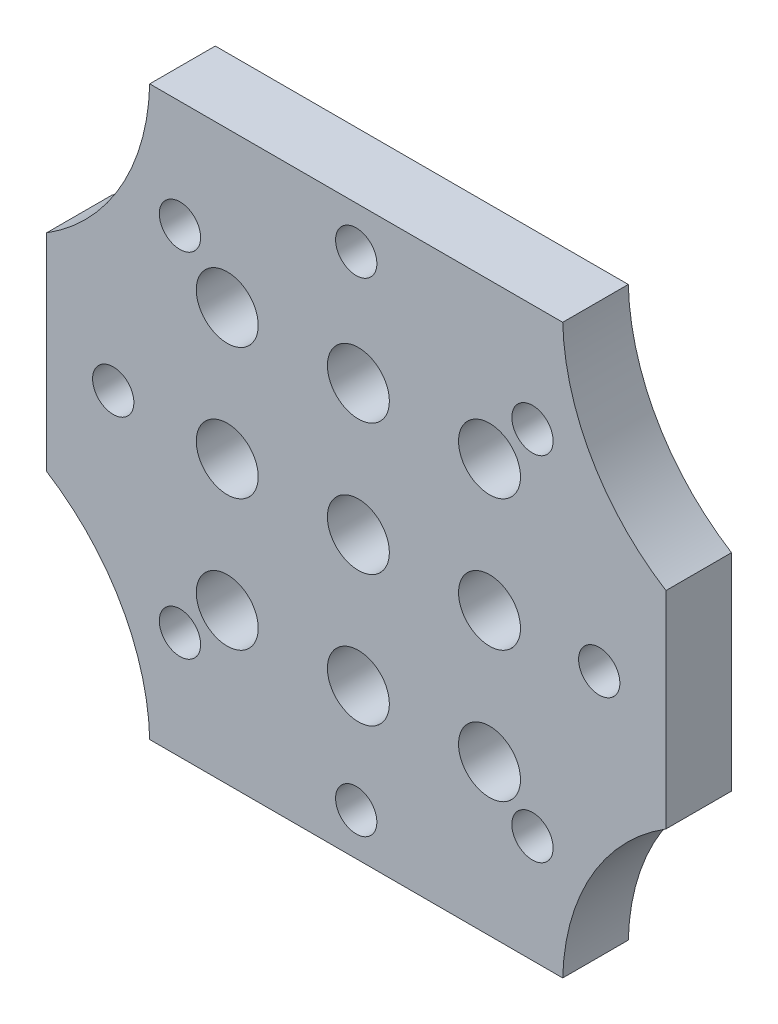
from build123d import *

# Parameters (mm, degrees)
SKETCH1_W                 = 60
SKETCH1_H                 = 55
BOSS_EXTRUDE1_DEPTH       = 6.35
SKETCH2_R                 = 2
CUT_EXTRUDE1_DEPTH        = 6.35
SKETCH3_R                 = 3
CUT_EXTRUDE2_DEPTH        = 42.189470742
LPATTERN1_COUNT           = 3
LPATTERN1_PITCH           = 12.7
LPATTERN2_COUNT           = 3
LPATTERN2_PITCH           = 12.7
LPATTERN2_COPY_1_SKETCH_R = 3
LPATTERN2_COPY_1_DEPTH    = 42.189470742
LPATTERN2_COPY_2_SKETCH_R = 3
LPATTERN2_COPY_2_DEPTH    = 42.189470742
LPATTERN2_COPY_3_SKETCH_R = 3
LPATTERN2_COPY_3_DEPTH    = 42.189470742
LPATTERN2_COPY_4_SKETCH_R = 3
LPATTERN2_COPY_4_DEPTH    = 42.189470742


with BuildPart() as part:
    # Sketch1 → Boss-Extrude1 (new body)
    with BuildSketch(Plane.XY):
        Rectangle(SKETCH1_W, SKETCH1_H)
    extrude(amount=BOSS_EXTRUDE1_DEPTH)

    # Sketch2 → Cut-Extrude1 (cut)
    with BuildSketch(Plane.XY.offset(6.35)):
        with BuildLine():
            Line((-30, 27.5), (-30, 10))
            ThreePointArc((-30, 10), (-22.799858447, 17.492776255), (-20, 27.5))
            Line((-20, 27.5), (-30, 27.5))
        make_face()
        with BuildLine():
            ThreePointArc((-20, -27.5), (-22.799858447, -17.492776255), (-30, -10))
            Line((-30, -10), (-30, -27.5))
            Line((-30, -27.5), (-20, -27.5))
        make_face()
        with BuildLine():
            ThreePointArc((30, -10), (22.799858447, -17.492776255), (20, -27.5))
            Line((20, -27.5), (30, -27.5))
            Line((30, -27.5), (30, -10))
        make_face()
        with BuildLine():
            Line((30, 27.5), (20, 27.5))
            ThreePointArc((20, 27.5), (22.799858447, 17.492776255), (30, 10))
            Line((30, 10), (30, 27.5))
        make_face()
        with Locations((17.07106781, 17.07106781)):
            Circle(SKETCH2_R)
        with Locations((23.535533905, 0)):
            Circle(SKETCH2_R)
        with Locations((17.07106781, -17.07106781)):
            Circle(SKETCH2_R)
        with Locations((-17.07106781, -17.07106781)):
            Circle(SKETCH2_R)
        with Locations((-23.535533905, 0)):
            Circle(SKETCH2_R)
        with Locations((-17.07106781, 17.07106781)):
            Circle(SKETCH2_R)
        with Locations((0, -23.42106781)):
            Circle(SKETCH2_R)
        with Locations((0, 23.42106781)):
            Circle(SKETCH2_R)
    extrude(amount=-CUT_EXTRUDE1_DEPTH, mode=Mode.SUBTRACT)

    # Sketch3 → Cut-Extrude2 (cut, through all)
    with BuildSketch(Plane.XY.offset(6.35)):
        with Locations((-12.490915526, 12.490915526)):
            Circle(SKETCH3_R)
    cut_extrude2 = extrude(amount=-CUT_EXTRUDE2_DEPTH, mode=Mode.SUBTRACT)

    # LPattern1: Cut-Extrude2 ×3
    with Locations(*[(i * LPATTERN1_PITCH, 0, 0) for i in range(1, LPATTERN1_COUNT)]):
        add(cut_extrude2, mode=Mode.SUBTRACT)

    # LPattern2: Cut-Extrude2 ×3
    with Locations(*[(0, -i * LPATTERN2_PITCH, 0) for i in range(1, LPATTERN2_COUNT)]):
        add(cut_extrude2, mode=Mode.SUBTRACT)

    # LPattern2 copy 1 sketch → LPattern2 copy 1 (cut, through all)
    with BuildSketch(Plane(origin=(12.7, -12.7, 6.35), x_dir=(1, 0, 0), z_dir=(0, 0, 1))):
        with Locations((-12.490915526, 12.490915526)):
            Circle(LPATTERN2_COPY_1_SKETCH_R)
    extrude(amount=-LPATTERN2_COPY_1_DEPTH, mode=Mode.SUBTRACT)

    # LPattern2 copy 2 sketch → LPattern2 copy 2 (cut, through all)
    with BuildSketch(Plane(origin=(12.7, -25.4, 6.35), x_dir=(1, 0, 0), z_dir=(0, 0, 1))):
        with Locations((-12.490915526, 12.490915526)):
            Circle(LPATTERN2_COPY_2_SKETCH_R)
    extrude(amount=-LPATTERN2_COPY_2_DEPTH, mode=Mode.SUBTRACT)

    # LPattern2 copy 3 sketch → LPattern2 copy 3 (cut, through all)
    with BuildSketch(Plane(origin=(25.4, -12.7, 6.35), x_dir=(1, 0, 0), z_dir=(0, 0, 1))):
        with Locations((-12.490915526, 12.490915526)):
            Circle(LPATTERN2_COPY_3_SKETCH_R)
    extrude(amount=-LPATTERN2_COPY_3_DEPTH, mode=Mode.SUBTRACT)

    # LPattern2 copy 4 sketch → LPattern2 copy 4 (cut, through all)
    with BuildSketch(Plane(origin=(25.4, -25.4, 6.35), x_dir=(1, 0, 0), z_dir=(0, 0, 1))):
        with Locations((-12.490915526, 12.490915526)):
            Circle(LPATTERN2_COPY_4_SKETCH_R)
    extrude(amount=-LPATTERN2_COPY_4_DEPTH, mode=Mode.SUBTRACT)


solid = part.part
